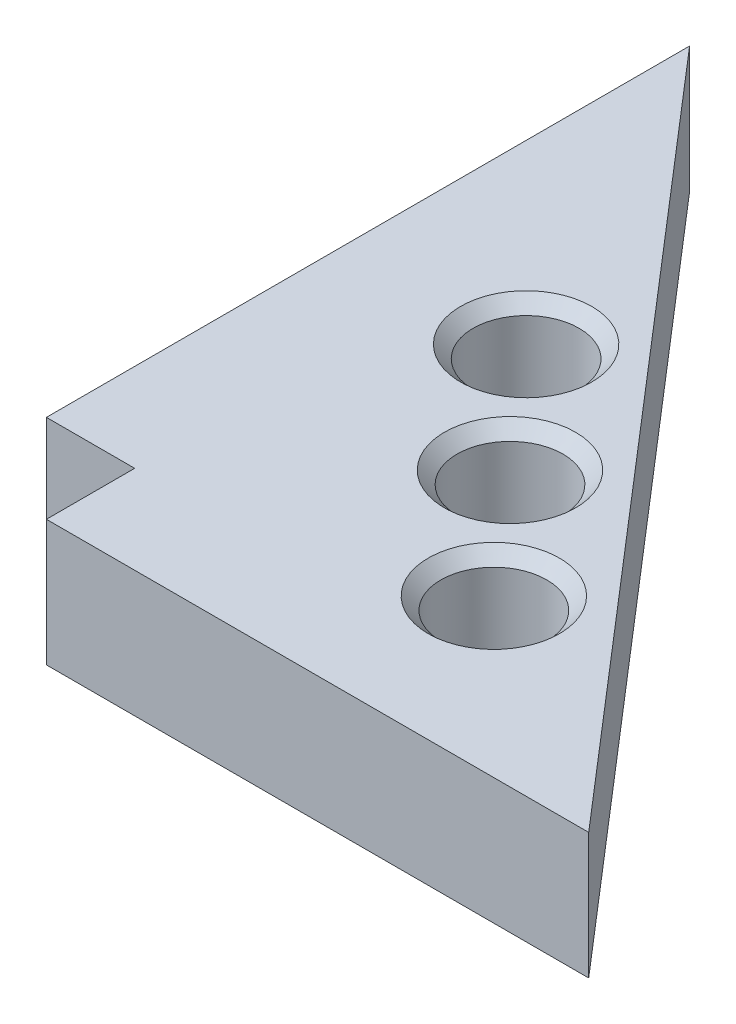
from build123d import *

# Parameters (mm, degrees)
SKETCH1_R           = 2.667
BOSS_EXTRUDE1_DEPTH = 3.175
CHAMFER1_SIZE       = 0.635


with BuildPart() as part:
    # Sketch1 → Boss-Extrude1 (new, symmetric)
    with BuildSketch(Plane(origin=(0, 0, 0), x_dir=(1, 0, 0), z_dir=(0, 1, 0))):
        Polygon((0, 36.83), (0, 4.445), (4.445, 4.445), (4.445, 0), (31.75, 0), align=None)
        with Locations(Location((8.89, 19.709926136, 0), (0, 0, 270))):
            Circle(SKETCH1_R, mode=Mode.SUBTRACT)
        with Locations(Location((13.97, 13.817126136, 0), (0, 0, 270))):
            Circle(SKETCH1_R, mode=Mode.SUBTRACT)
        with Locations(Location((19.05, 7.924326136, 0), (0, 0, 270))):
            Circle(SKETCH1_R, mode=Mode.SUBTRACT)
    extrude(amount=BOSS_EXTRUDE1_DEPTH, both=True)

    # Chamfer1
    chamfer1_edges = [part.edges().sort_by_distance(p)[0] for p in [
        (8.89, -3.175, -22.376926136),
        (8.89, 3.175, -22.376926136),
        (13.97, -3.175, -16.484126136),
        (13.97, 3.175, -16.484126136),
        (19.05, -3.175, -10.591326136),
        (19.05, 3.175, -10.591326136),
    ]]
    chamfer(chamfer1_edges, length=CHAMFER1_SIZE)


solid = part.part
